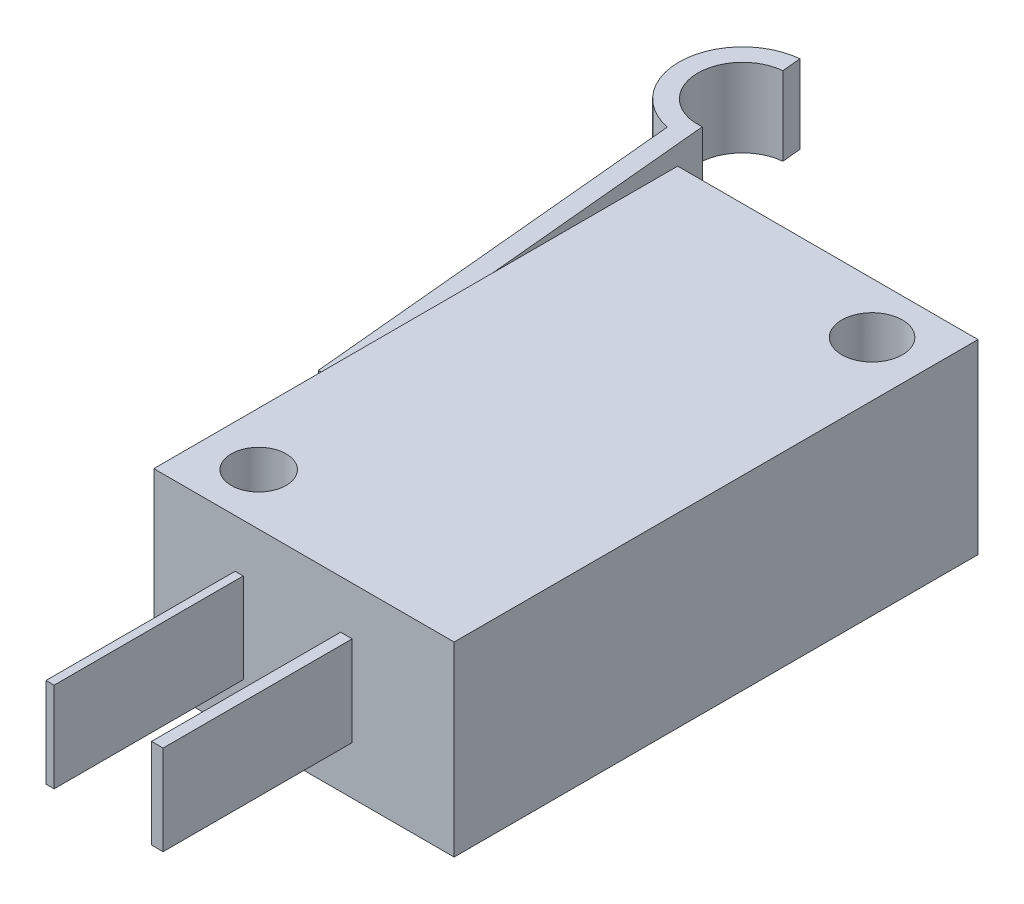
from build123d import *

# Parameters (mm, degrees)
SKETCH1_W           = 15.88
SKETCH1_H           = 27.7
BOSS_EXTRUDE1_DEPTH = 9.85
SKETCH2_W           = 0.61
SKETCH2_H           = 4.75
SKETCH2_W_2         = 0.43
BOSS_EXTRUDE2_DEPTH = 10
SKETCH4_R           = 1.45
SKETCH4_R_2         = 1.6
CUT_EXTRUDE1_DEPTH  = 10
SKETCH5_W           = 1
SKETCH5_H           = 4.15
BOSS_EXTRUDE3_DEPTH = 3
SKETCH7_R           = 3.362536074
SKETCH7_R_2         = 2.362536074
BOSS_EXTRUDE5_DEPTH = 4.15
CUT_EXTRUDE2_DEPTH  = 43.42645861


with BuildPart() as part:
    # Sketch1 → Boss-Extrude1 (new body)
    with BuildSketch(Plane(origin=(0, 0, 0), x_dir=(1, 0, 0), z_dir=(0, 1, 0))):
        with Locations((7.94, 13.85)):
            Rectangle(SKETCH1_W, SKETCH1_H)
    extrude(amount=BOSS_EXTRUDE1_DEPTH)

    # Sketch2 → Boss-Extrude2 (add)
    with BuildSketch(Plane.XY):
        with Locations((10.185, 4.925)):
            Rectangle(SKETCH2_W, SKETCH2_H)
        with Locations((4.515, 4.925)):
            Rectangle(SKETCH2_W_2, SKETCH2_H)
    extrude(amount=BOSS_EXTRUDE2_DEPTH)

    # Sketch4 → Cut-Extrude1 (cut)
    with BuildSketch(Plane(origin=(0, 9.85, 0), x_dir=(1, 0, 0), z_dir=(0, 1, 0))):
        with Locations(Location((2.82, 2.725, 0), (0, 0, 270))):
            Circle(SKETCH4_R)
        with Locations(Location((12.98, 25, 0), (0, 0, 270))):
            Circle(SKETCH4_R_2)
    extrude(amount=-CUT_EXTRUDE1_DEPTH, mode=Mode.SUBTRACT)

    # Sketch5 → Boss-Extrude3 (add)
    with BuildSketch(Plane.ZY):
        with Locations((-12.2, 4.925)):
            Rectangle(SKETCH5_W, SKETCH5_H)
    extrude(amount=BOSS_EXTRUDE3_DEPTH)

    # Sketch7 → Boss-Extrude5 (add)
    # profile 1 of 2: a face of its own
    with BuildSketch(Plane(origin=(0, 7, 0), x_dir=(1, 0, 0), z_dir=(0, 1, 0))):
        with Locations((-4.220862881, 35.35218968)):
            Circle(SKETCH7_R)
        with Locations((-4.220862881, 35.35218968)):
            Circle(SKETCH7_R_2, mode=Mode.SUBTRACT)
    # profile 2 of 2: a face of its own
    with BuildSketch(Plane(origin=(0, 7, 0), x_dir=(1, 0, 0), z_dir=(0, 1, 0))):
        Polygon((-3, 11.7), (-5, 33), (-4, 33), (-2, 11.7), align=None)
    extrude(amount=-BOSS_EXTRUDE5_DEPTH)

    # Sketch8 → Cut-Extrude2 (cut, through all)
    with BuildSketch(Plane(origin=(0, 2.85, 0), x_dir=(-1, 0, 0), z_dir=(0, -1, 0))):
        Polygon((3.906514494, 32.004379359), (-0.89687697, 32.455402032), (-0.268180196, 39.151022673), (4.535211268, 38.7), align=None)
    extrude(amount=-CUT_EXTRUDE2_DEPTH, mode=Mode.SUBTRACT)


solid = part.part
